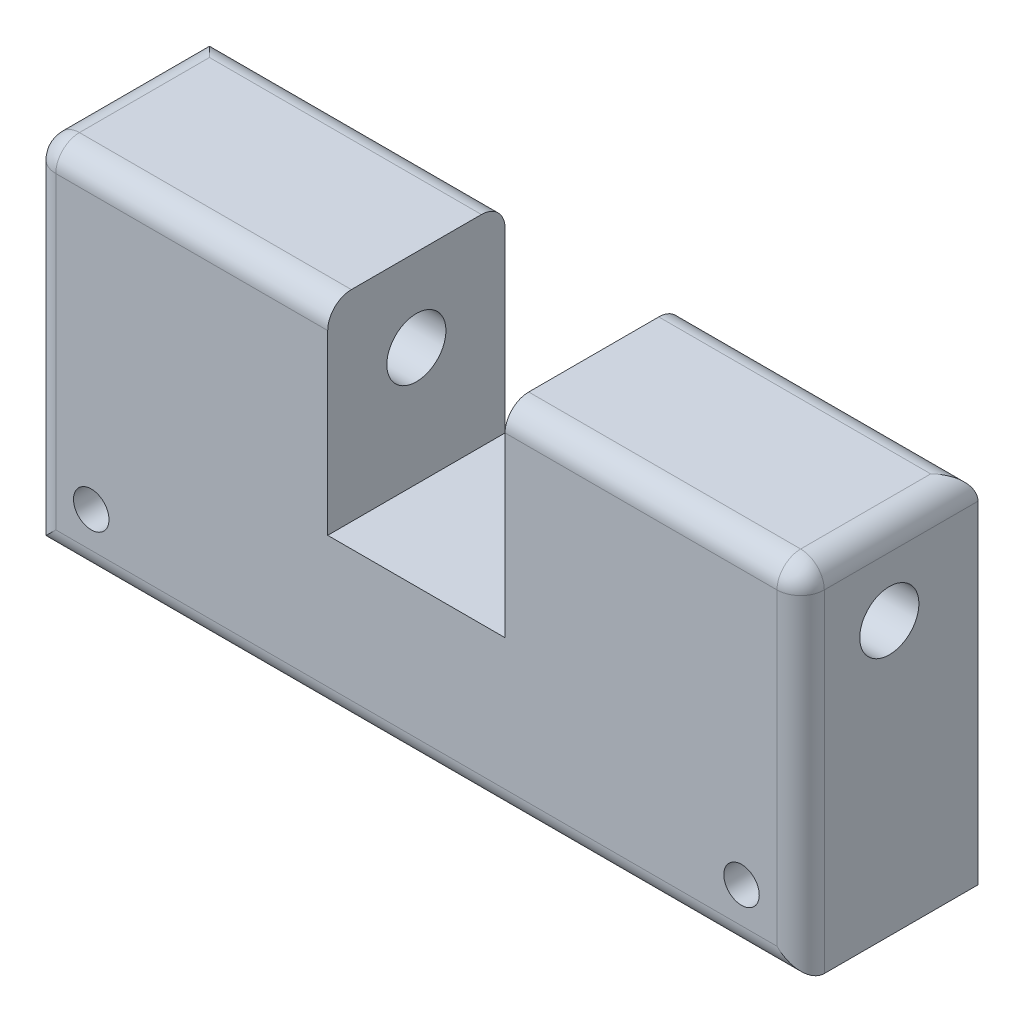
from build123d import *

# Parameters (mm, degrees)
SKETCH1_W           = 65
SKETCH1_H           = 30.1
SKETCH1_R           = 1.5
BOSS_EXTRUDE1_DEPTH = 15
SKETCH2_R           = 2.5
CUT_EXTRUDE1_DEPTH  = 75
SKETCH3_W           = 15
SKETCH3_H           = 17
CUT_EXTRUDE2_DEPTH  = 75
FILLET2_R           = 2


with BuildPart() as part:
    # Sketch1 → Boss-Extrude1 (new body)
    with BuildSketch(Plane.XY):
        with Locations((10, 0.55)):
            Rectangle(SKETCH1_W, SKETCH1_H)
        with Locations((-17.5, -9.5)):
            Circle(SKETCH1_R, mode=Mode.SUBTRACT)
        with Locations((37.5, -9.5)):
            Circle(SKETCH1_R, mode=Mode.SUBTRACT)
    extrude(amount=BOSS_EXTRUDE1_DEPTH)

    # Sketch2 → Cut-Extrude1 (cut)
    with BuildSketch(Plane.ZY.offset(22.5)):
        with Locations((7.5, 8.6)):
            Circle(SKETCH2_R)
    extrude(amount=-CUT_EXTRUDE1_DEPTH, mode=Mode.SUBTRACT)

    # Sketch3 → Cut-Extrude2 (cut)
    with BuildSketch(Plane.XY.offset(15)):
        with Locations((10, 7.1)):
            Rectangle(SKETCH3_W, SKETCH3_H)
    extrude(amount=-CUT_EXTRUDE2_DEPTH, mode=Mode.SUBTRACT)

    # Fillet2
    fillet2_edges = [part.edges().sort_by_distance(p)[0] for p in [
        (42.5, 0.55, 15),
        (30, 15.6, 15),
        (-10, 15.6, 0),
        (-10, 15.6, 15),
        (-22.5, 0.55, 15),
        (30, 15.6, 0),
        (-22.5, 15.6, 7.5),
        (42.5, 15.6, 7.5),
        (10, -14.5, 15),
    ]]
    fillet(fillet2_edges, radius=FILLET2_R)


solid = part.part
